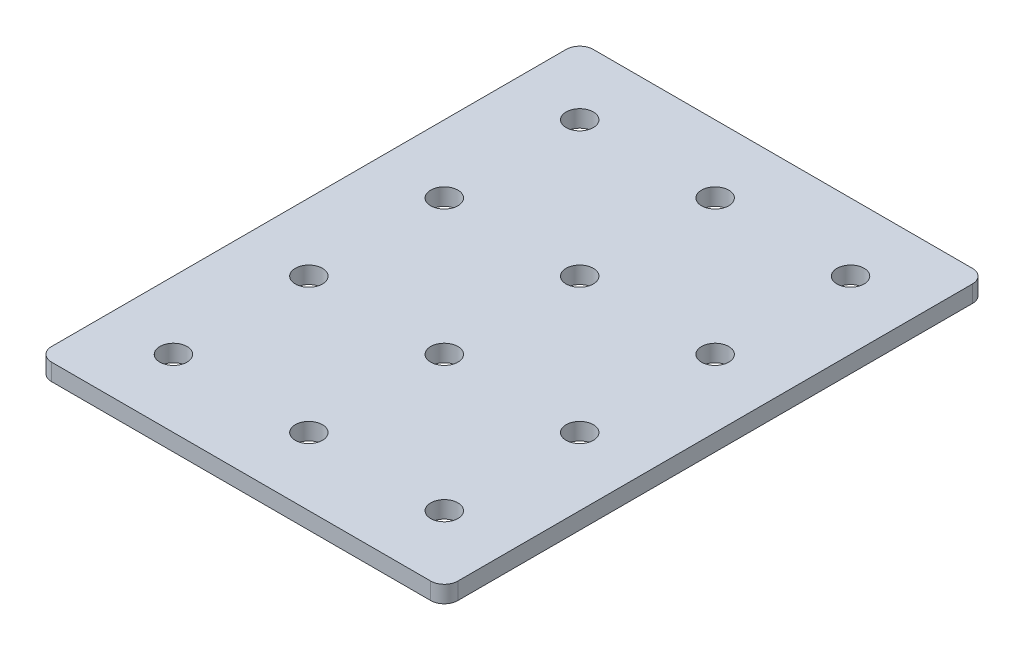
from build123d import *

# Parameters (mm, degrees)
SKETCH1_W            = 76.2
SKETCH1_H            = 101.6
BOSS_EXTRUDE1_DEPTH  = 3.175
SKETCH2_R            = 2.5527
CUT_EXTRUDE1_DEPTH   = 3.175
LPATTERN1_COUNT      = 4
LPATTERN1_PITCH      = 25.4
LPATTERN1_COUNT_DIR2 = 3
LPATTERN1_PITCH_DIR2 = 25.4
FILLET1_R            = 2.54


with BuildPart() as part:
    # Sketch1 → Boss-Extrude1 (new body)
    with BuildSketch(Plane(origin=(0, 0, 0), x_dir=(1, 0, 0), z_dir=(0, 1, 0))):
        Rectangle(SKETCH1_W, SKETCH1_H)
    extrude(amount=BOSS_EXTRUDE1_DEPTH)

    # Sketch2 → Cut-Extrude1 (cut)
    with BuildSketch(Plane(origin=(0, 3.175, 0), x_dir=(1, 0, 0), z_dir=(0, 1, 0))):
        with Locations(Location((-25.4, -38.1, 0), (0, 0, 270))):
            Circle(SKETCH2_R)
    cut_extrude1 = extrude(amount=-CUT_EXTRUDE1_DEPTH, mode=Mode.SUBTRACT)

    # LPattern1: Cut-Extrude1 4 × 3
    with Locations(*[(j * LPATTERN1_PITCH_DIR2, 0, -i * LPATTERN1_PITCH) for i in range(LPATTERN1_COUNT) for j in range(LPATTERN1_COUNT_DIR2) if (i, j) != (0, 0)]):
        add(cut_extrude1, mode=Mode.SUBTRACT)

    # Fillet1
    fillet1_edges = [part.edges().sort_by_distance(p)[0] for p in [
        (38.1, 1.5875, 50.8),
        (-38.1, 1.5875, 50.8),
        (-38.1, 1.5875, -50.8),
        (38.1, 1.5875, -50.8),
    ]]
    fillet(fillet1_edges, radius=FILLET1_R)


solid = part.part
